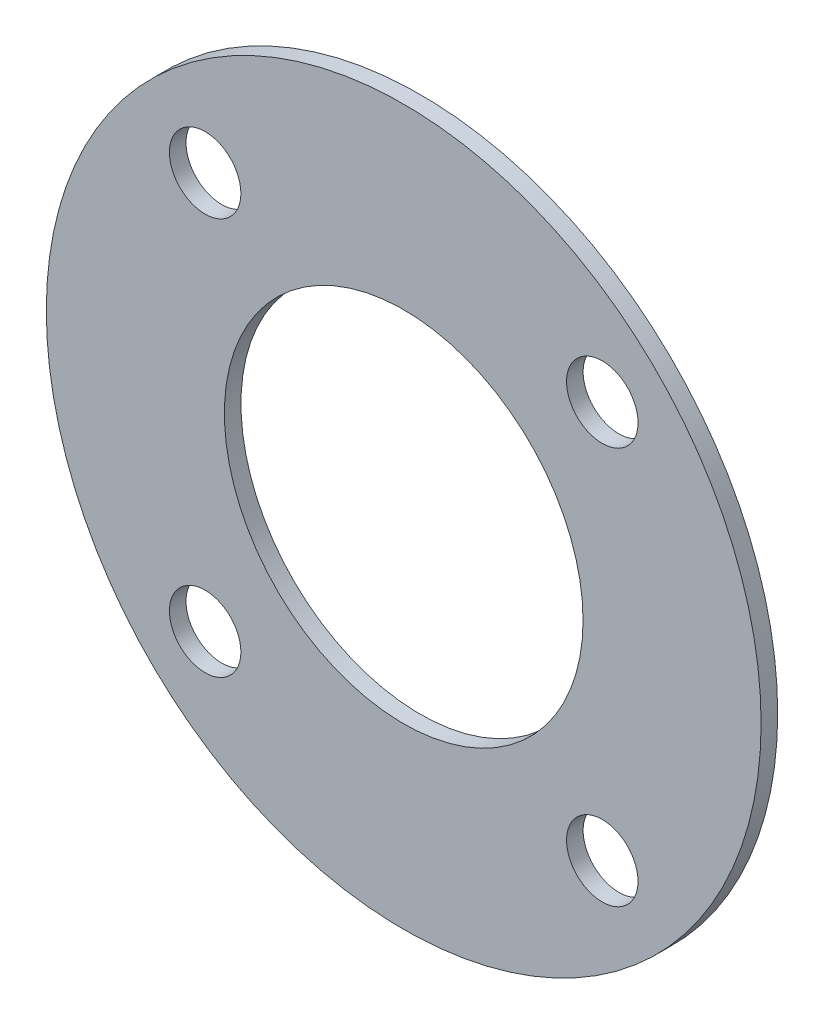
from build123d import *

# Parameters (mm, degrees)
HUB_ENDPLATE_AXIAL_CLEARANCE_SHIM_H0P65_START = 3
SKETCH1_R                                     = 14
SKETCH1_R_2                                   = 7.025
HUB_ENDPLATE_AXIAL_CLEARANCE_SHIM_H0P65_DEPTH = 0.65
SKETCH2_R                                     = 1.4
FOUR_D2P8_PCD22_DEPTH                         = 20.809656736


with BuildPart() as part:
    # Sketch1 → Hub_Endplate_Axial_Clearance_Shim_H0p65 (new body)
    with BuildSketch(Plane.XY.offset(HUB_ENDPLATE_AXIAL_CLEARANCE_SHIM_H0P65_START)):
        Circle(SKETCH1_R)
        Circle(SKETCH1_R_2, mode=Mode.SUBTRACT)
    extrude(amount=HUB_ENDPLATE_AXIAL_CLEARANCE_SHIM_H0P65_DEPTH)

    # Sketch2 → Four_D2p8_PCD22 (cut, through all)
    with BuildSketch(Plane.XY.offset(3.65)):
        with Locations((7.778174593, 7.778174593)):
            Circle(SKETCH2_R)
        with Locations((-7.778174593, 7.778174593)):
            Circle(SKETCH2_R)
        with Locations((-7.778174593, -7.778174593)):
            Circle(SKETCH2_R)
        with Locations((7.778174593, -7.778174593)):
            Circle(SKETCH2_R)
    extrude(amount=-FOUR_D2P8_PCD22_DEPTH, mode=Mode.SUBTRACT)


solid = part.part
